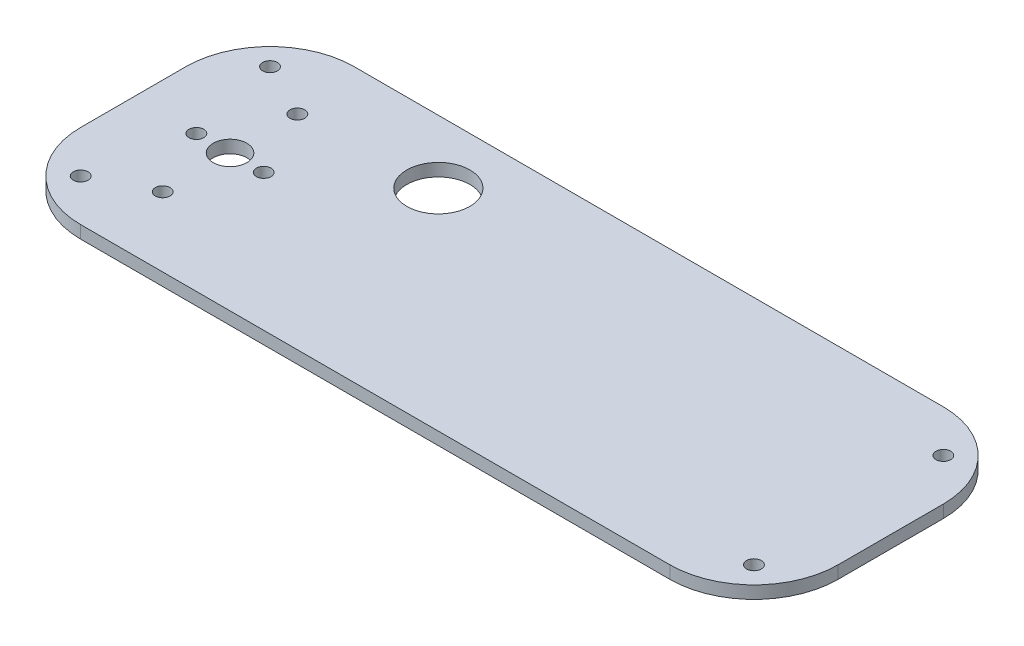
from build123d import *

# Parameters (mm, degrees)
CROQUIS1_W              = 180
CROQUIS1_H              = 65
SALIENTE_EXTRUIR1_DEPTH = 3
REDONDEO1_R             = 20
CROQUIS2_R              = 1.75
CORTAR_EXTRUIR1_DEPTH   = 3
CROQUIS3_R              = 1.75
CROQUIS3_R_2            = 4
CORTAR_EXTRUIR2_DEPTH   = 3
CROQUIS4_R              = 7.5
CORTAR_EXTRUIR3_DEPTH   = 200


with BuildPart() as part:
    # Croquis1 → Saliente-Extruir1 (new body)
    with BuildSketch(Plane(origin=(0, 0, 0), x_dir=(1, 0, 0), z_dir=(0, 1, 0))):
        Rectangle(CROQUIS1_W, CROQUIS1_H)
    extrude(amount=SALIENTE_EXTRUIR1_DEPTH)

    # Redondeo1
    redondeo1_edges = [part.edges().sort_by_distance(p)[0] for p in [
        (90, 1.5, 32.5),
        (-90, 1.5, 32.5),
        (-90, 1.5, -32.5),
        (90, 1.5, -32.5),
    ]]
    fillet(redondeo1_edges, radius=REDONDEO1_R)

    # Croquis2 → Cortar-Extruir1 (cut)
    with BuildSketch(Plane(origin=(0, 3, 0), x_dir=(1, 0, 0), z_dir=(0, 1, 0))):
        with Locations(Location((-80, 22.5, 0), (0, 0, 270))):
            Circle(CROQUIS2_R)
        with Locations(Location((-80, -22.5, 0), (0, 0, 270))):
            Circle(CROQUIS2_R)
        with Locations(Location((80, -22.5, 0), (0, 0, 270))):
            Circle(CROQUIS2_R)
        with Locations(Location((80, 22.5, 0), (0, 0, 270))):
            Circle(CROQUIS2_R)
    extrude(amount=-CORTAR_EXTRUIR1_DEPTH, mode=Mode.SUBTRACT)

    # Croquis3 → Cortar-Extruir2 (cut)
    with BuildSketch(Plane.XZ):
        with Locations(Location((-67, 16, 0), (0, 0, 270))):
            Circle(CROQUIS3_R)
        with Locations(Location((-59, 0, 0), (0, 0, 270))):
            Circle(CROQUIS3_R)
        with Locations(Location((-67, -16, 0), (0, 0, 270))):
            Circle(CROQUIS3_R)
        with Locations(Location((-67, 0, 0), (0, 0, 270))):
            Circle(CROQUIS3_R_2)
        with Locations(Location((-75, 0, 0), (0, 0, 270))):
            Circle(CROQUIS3_R)
    extrude(amount=-CORTAR_EXTRUIR2_DEPTH, mode=Mode.SUBTRACT)

    # Croquis4 → Cortar-Extruir3 (cut)
    with BuildSketch(Plane.XZ):
        with Locations(Location((-35, -17.5, 0), (0, 0, 270))):
            Circle(CROQUIS4_R)
    extrude(amount=-CORTAR_EXTRUIR3_DEPTH, mode=Mode.SUBTRACT)


solid = part.part
